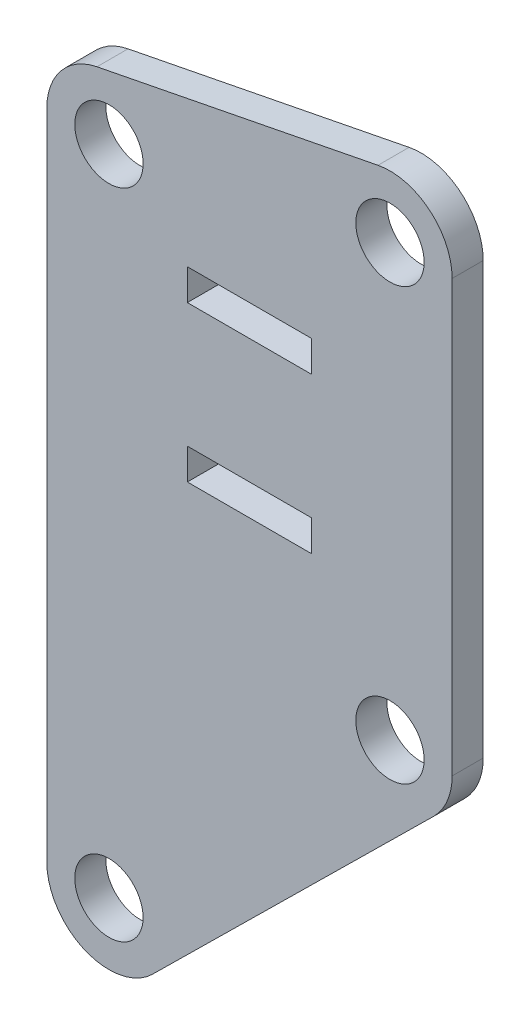
from build123d import *

# Parameters (mm, degrees)
EXTRUDE_1_DEPTH     = 5
SKETCH_2_W          = 20
SKETCH_2_H          = 5
CUT_EXTRUDE_1_DEPTH = 75.656062131
SKETCH_3_R          = 5.5
CUT_EXTRUDE_2_DEPTH = 75.656062131


with BuildPart() as part:
    # Эскиз1 → Бобышка-Вытянуть1 (new body)
    with BuildSketch(Plane.XY):
        with BuildLine():
            Line((-15.590383156, -64.089313216), (29.634829502, -19.482516982))
            ThreePointArc((29.634829502, -19.482516982), (31.838174922, -16.221551312), (32.612606329, -12.362939627))
            Line((32.612606329, -12.362939627), (32.612606329, 56.969735861))
            ThreePointArc((32.612606329, 56.969735861), (28.965607908, 64.692388963), (20.684732142, 66.782141332))
            Line((20.684732142, 66.782141332), (-24.540480515, 57.896601459))
            ThreePointArc((-24.540480515, 57.896601459), (-30.335259431, 54.437197567), (-32.612606329, 48.084195988))
            Line((-32.612606329, 48.084195988), (-32.612606329, -56.969735861))
            ThreePointArc((-32.612606329, -56.969735861), (-26.471218014, -66.195304454), (-15.590383156, -64.089313216))
        make_face()
    extrude(amount=EXTRUDE_1_DEPTH)

    # Эскиз2 → Вырез-Вытянуть1 (cut, through all)
    with BuildSketch(Plane.XY.offset(5)):
        with Locations((0, 34.803398117)):
            Rectangle(SKETCH_2_W, SKETCH_2_H)
        with Locations((0, 9.803398117)):
            Rectangle(SKETCH_2_W, SKETCH_2_H)
    extrude(amount=-CUT_EXTRUDE_1_DEPTH, mode=Mode.SUBTRACT)

    # Эскиз3 → Вырез-Вытянуть2 (cut, through all)
    with BuildSketch(Plane.XY.offset(5)):
        with Locations((22.612606329, 56.969735861)):
            Circle(SKETCH_3_R)
        with Locations((-22.612606329, -56.969735861)):
            Circle(SKETCH_3_R)
        with Locations((-22.612606329, 48.084195988)):
            Circle(SKETCH_3_R)
        with Locations((22.612606329, -12.362939627)):
            Circle(SKETCH_3_R)
    extrude(amount=-CUT_EXTRUDE_2_DEPTH, mode=Mode.SUBTRACT)


solid = part.part
